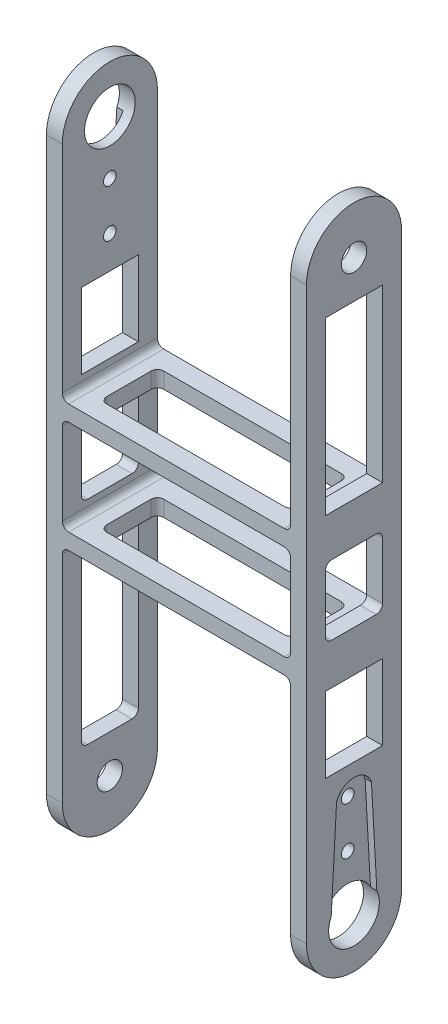
from build123d import *
from build123d.topology import SkipClean

# Parameters (mm, degrees)
EXTRUDE_1_DEPTH                 = 2.5
SKETCH_6_R                      = 2
CUT_EXTRUDE_1_DEPTH             = 3
EXTRUDE_2_DEPTH                 = 2.5
CUT_EXTRUDE_2_DEPTH             = 1
SKETCH_8_R                      = 4
SKETCH_8_R_2                    = 1
CUT_EXTRUDE_3_DEPTH             = 1.5
SKETCH_9_R                      = 2
CUT_EXTRUDE_4_DEPTH             = 2.5
CUT_EXTRUDE_5_DEPTH             = 1
SKETCH_11_R                     = 4
SKETCH_11_R_2                   = 1
CUT_EXTRUDE_6_DEPTH             = 1.5
EXTRUDE_3_REACH                 = 101.914
SKETCH_12_W                     = 36
SKETCH_12_H                     = 2.5
EXTRUDE_3_DIRECTION_2_REACH     = 101.914
CUT_EXTRUDE_7_REACH             = 108.035
SKETCH_13_W                     = 9
SKETCH_13_H                     = 27
SKETCH_13_H_2                   = 11
SKETCH_13_H_3                   = 11.890625
CUT_EXTRUDE_8_REACH             = 108.035
SKETCH_14_W                     = 9
SKETCH_14_H                     = 27
SKETCH_14_H_2                   = 11
SKETCH_14_H_3                   = 11.890625
CUT_EXTRUDE_8_DIRECTION_2_DEPTH = 107.035371457
CUT_EXTRUDE_9_DEPTH             = 57.857277459
CUT_EXTRUDE_9_DEPTH_BACK        = 57.857277459
SKETCH_15_W                     = 30
SKETCH_15_H                     = 9
FILLET_1_R                      = 1


with BuildPart() as part:
    # 草图4 → 凸台-拉伸1 (new body)
    with BuildSketch(Plane.ZY.offset(18)):
        with BuildLine():
            Line((-7.5, 90), (-7.5, 0))
            ThreePointArc((-7.5, 0), (0, -7.5), (7.5, 0))
            Line((7.5, 0), (7.5, 90))
            ThreePointArc((7.5, 90), (0, 97.5), (-7.5, 90))
        make_face()
    extrude(amount=EXTRUDE_1_DEPTH)

    # 草图6 → 切除-拉伸1 (cut)
    with BuildSketch(Plane.ZY.offset(20.5)):
        Circle(SKETCH_6_R)
    extrude(amount=-CUT_EXTRUDE_1_DEPTH, mode=Mode.SUBTRACT)

    # 草图10 → 切除-拉伸5 (cut)
    with BuildSketch(Plane.ZY.offset(20.5)):
        with BuildLine():
            Line((-2.75, 73), (-3.6, 88.256440423))
            ThreePointArc((-3.6, 88.256440423), (0, 94), (3.6, 88.256440423))
            Line((3.6, 88.256440423), (2.75, 73))
            ThreePointArc((2.75, 73), (0, 71), (-2.75, 73))
        make_face()
    extrude(amount=-CUT_EXTRUDE_5_DEPTH, mode=Mode.SUBTRACT)

    # 草图11 → 切除-拉伸6 (cut)
    with SkipClean():  # the faces are left unmerged after this step: merging them gives an invalid solid
        with BuildSketch(Plane.ZY.offset(19.5)):
            with Locations((0, 90)):
                Circle(SKETCH_11_R)
            with Locations((0, 74.05)):
                Circle(SKETCH_11_R_2)
            with Locations((0, 81.55)):
                Circle(SKETCH_11_R_2)
        extrude(amount=-CUT_EXTRUDE_6_DEPTH, mode=Mode.SUBTRACT)

    # 凸台-拉伸3: up to this face of the body (flat: up to its plane)
    extrude_3_end = Plane(part.part.faces().sort_by_distance((-19.25, 45, 7.5))[0])
    # 草图12 → 凸台-拉伸3 (add, up to the picked face)
    with BuildSketch(Plane.XY, mode=Mode.PRIVATE) as extrude_3_sk1:
        with Locations((0, 53.75)):
            Rectangle(SKETCH_12_W, SKETCH_12_H)
    extrude_3_tool1 = split(extrude(extrude_3_sk1.sketch, amount=EXTRUDE_3_REACH, mode=Mode.PRIVATE), bisect_by=extrude_3_end, keep=Keep.BOTH, mode=Mode.PRIVATE)
    # 草图12 → 凸台-拉伸3 (add, up to the picked face)
    with BuildSketch(Plane.XY, mode=Mode.PRIVATE) as extrude_3_sk2:
        with Locations((0, 36.25)):
            Rectangle(SKETCH_12_W, SKETCH_12_H)
    extrude_3_tool2 = split(extrude(extrude_3_sk2.sketch, amount=EXTRUDE_3_REACH, mode=Mode.PRIVATE), bisect_by=extrude_3_end, keep=Keep.BOTH, mode=Mode.PRIVATE)


with BuildPart() as body_2:
    # 草图5 → 凸台-拉伸2 (new body)
    with BuildSketch(Plane(origin=(18, 0, 0), x_dir=(0, 0, -1), z_dir=(1, 0, 0))):
        with BuildLine():
            Line((-7.5, 0), (-7.5, 90))
            ThreePointArc((-7.5, 90), (0, 97.5), (7.5, 90))
            Line((7.5, 90), (7.5, 0))
            ThreePointArc((7.5, 0), (0, -7.5), (-7.5, 0))
        make_face()
    extrude(amount=EXTRUDE_2_DEPTH)

    # 草图7 → 切除-拉伸2 (cut)
    with BuildSketch(Plane(origin=(20.5, 0, 0), x_dir=(0, 0, -1), z_dir=(1, 0, 0))):
        with BuildLine():
            Line((-3.6, 1.743559577), (-2.75, 17))
            ThreePointArc((-2.75, 17), (0, 19), (2.75, 17))
            Line((2.75, 17), (3.6, 1.743559577))
            ThreePointArc((3.6, 1.743559577), (0, -4), (-3.6, 1.743559577))
        make_face()
    extrude(amount=-CUT_EXTRUDE_2_DEPTH, mode=Mode.SUBTRACT)

    # 草图8 → 切除-拉伸3 (cut)
    with SkipClean():  # the faces are left unmerged after this step: merging them gives an invalid solid
        with BuildSketch(Plane(origin=(19.5, 0, 0), x_dir=(0, 0, -1), z_dir=(1, 0, 0))):
            Circle(SKETCH_8_R)
            with Locations((0, 15.95)):
                Circle(SKETCH_8_R_2)
            with Locations((0, 8.45)):
                Circle(SKETCH_8_R_2)
        extrude(amount=-CUT_EXTRUDE_3_DEPTH, mode=Mode.SUBTRACT)

    # 草图9 → 切除-拉伸4 (cut)
    with SkipClean():  # the faces are left unmerged after this step: merging them gives an invalid solid
        with BuildSketch(Plane(origin=(20.5, 0, 0), x_dir=(0, 0, -1), z_dir=(1, 0, 0))):
            with Locations((0, 90)):
                Circle(SKETCH_9_R)
        extrude(amount=-CUT_EXTRUDE_4_DEPTH, mode=Mode.SUBTRACT)


with BuildPart() as part_1:
    add(part.part)

    add(body_2.part)  # 凸台-拉伸3 merges body 2
    add(extrude_3_tool1.solids().sort_by(Axis((0, 53.75, 0), (0, 0, 1)))[0])
    add(extrude_3_tool2.solids().sort_by(Axis((0, 36.25, 0), (0, 0, 1)))[0])

    # 凸台-拉伸3 direction 2: up to this face of the body (flat: up to its plane)
    extrude_3_direction_2_end = Plane(part_1.part.faces().sort_by_distance((-19.25, 45, -7.5))[0])
    # 草图12 → 凸台-拉伸3 direction 2 (add, up to the picked face)
    with BuildSketch(Plane.XY, mode=Mode.PRIVATE) as extrude_3_direction_2_sk1:
        with Locations((0, 53.75)):
            Rectangle(SKETCH_12_W, SKETCH_12_H)
    extrude_3_direction_2_tool1 = split(extrude(extrude_3_direction_2_sk1.sketch, amount=-EXTRUDE_3_DIRECTION_2_REACH, mode=Mode.PRIVATE), bisect_by=extrude_3_direction_2_end, keep=Keep.BOTH, mode=Mode.PRIVATE)
    # 草图12 → 凸台-拉伸3 direction 2 (add, up to the picked face)
    with BuildSketch(Plane.XY, mode=Mode.PRIVATE) as extrude_3_direction_2_sk2:
        with Locations((0, 36.25)):
            Rectangle(SKETCH_12_W, SKETCH_12_H)
    extrude_3_direction_2_tool2 = split(extrude(extrude_3_direction_2_sk2.sketch, amount=-EXTRUDE_3_DIRECTION_2_REACH, mode=Mode.PRIVATE), bisect_by=extrude_3_direction_2_end, keep=Keep.BOTH, mode=Mode.PRIVATE)
    add(extrude_3_direction_2_tool1.solids().sort_by(Axis((0, 53.75, 0), (0, 0, -1)))[0])
    add(extrude_3_direction_2_tool2.solids().sort_by(Axis((0, 36.25, 0), (0, 0, -1)))[0])

    # 草图13 → 切除-拉伸7 (cut, up to next)
    with BuildSketch(Plane.ZY.offset(20.5), mode=Mode.PRIVATE) as cut_extrude_7_sk1:
        with Locations((0, 19.5)):
            Rectangle(SKETCH_13_W, SKETCH_13_H)
    cut_extrude_7_tool1 = extrude(cut_extrude_7_sk1.sketch, amount=-CUT_EXTRUDE_7_REACH, mode=Mode.PRIVATE) & part_1.part
    # 草图13 → 切除-拉伸7 (cut, up to next)
    with BuildSketch(Plane.ZY.offset(20.5), mode=Mode.PRIVATE) as cut_extrude_7_sk2:
        with Locations((0, 45)):
            Rectangle(SKETCH_13_W, SKETCH_13_H_2)
    cut_extrude_7_tool2 = extrude(cut_extrude_7_sk2.sketch, amount=-CUT_EXTRUDE_7_REACH, mode=Mode.PRIVATE) & part_1.part
    # 草图13 → 切除-拉伸7 (cut, up to next)
    with BuildSketch(Plane.ZY.offset(20.5), mode=Mode.PRIVATE) as cut_extrude_7_sk3:
        with Locations((0, 62.9453125)):
            Rectangle(SKETCH_13_W, SKETCH_13_H_3)
    cut_extrude_7_tool3 = extrude(cut_extrude_7_sk3.sketch, amount=-CUT_EXTRUDE_7_REACH, mode=Mode.PRIVATE) & part_1.part
    add(cut_extrude_7_tool1.solids().sort_by_distance((-20.5, 19.5, 0))[0], mode=Mode.SUBTRACT)
    add(cut_extrude_7_tool2.solids().sort_by_distance((-20.5, 45, 0))[0], mode=Mode.SUBTRACT)
    add(cut_extrude_7_tool3.solids().sort_by_distance((-20.5, 62.945312, 0))[0], mode=Mode.SUBTRACT)

    # 草图14 → 切除-拉伸8 (cut, up to next)
    with BuildSketch(Plane(origin=(20.5, 0, 0), x_dir=(0, 0, -1), z_dir=(1, 0, 0)), mode=Mode.PRIVATE) as cut_extrude_8_sk1:
        with Locations((0, 70.5)):
            Rectangle(SKETCH_14_W, SKETCH_14_H)
    cut_extrude_8_tool1 = extrude(cut_extrude_8_sk1.sketch, amount=-CUT_EXTRUDE_8_REACH, mode=Mode.PRIVATE) & part_1.part
    # 草图14 → 切除-拉伸8 (cut, up to next)
    with BuildSketch(Plane(origin=(20.5, 0, 0), x_dir=(0, 0, -1), z_dir=(1, 0, 0)), mode=Mode.PRIVATE) as cut_extrude_8_sk2:
        with Locations((0, 45)):
            Rectangle(SKETCH_14_W, SKETCH_14_H_2)
    cut_extrude_8_tool2 = extrude(cut_extrude_8_sk2.sketch, amount=-CUT_EXTRUDE_8_REACH, mode=Mode.PRIVATE) & part_1.part
    # 草图14 → 切除-拉伸8 (cut, up to next)
    with BuildSketch(Plane(origin=(20.5, 0, 0), x_dir=(0, 0, -1), z_dir=(1, 0, 0)), mode=Mode.PRIVATE) as cut_extrude_8_sk3:
        with Locations((0, 27.0546875)):
            Rectangle(SKETCH_14_W, SKETCH_14_H_3)
    cut_extrude_8_tool3 = extrude(cut_extrude_8_sk3.sketch, amount=-CUT_EXTRUDE_8_REACH, mode=Mode.PRIVATE) & part_1.part
    add(cut_extrude_8_tool1.solids().sort_by_distance((20.5, 70.5, 0))[0], mode=Mode.SUBTRACT)
    add(cut_extrude_8_tool2.solids().sort_by_distance((20.5, 45, 0))[0], mode=Mode.SUBTRACT)
    add(cut_extrude_8_tool3.solids().sort_by_distance((20.5, 27.054688, 0))[0], mode=Mode.SUBTRACT)

    # 草图14 → 切除-拉伸8 direction 2 (cut)
    with SkipClean():  # the faces are left unmerged after this step: merging them gives an invalid solid
        with BuildSketch(Plane(origin=(20.5, 0, 0), x_dir=(0, 0, -1), z_dir=(1, 0, 0))):
            with Locations((0, 70.5)):
                Rectangle(SKETCH_14_W, SKETCH_14_H)
            with Locations((0, 45)):
                Rectangle(SKETCH_14_W, SKETCH_14_H_2)
            with Locations((0, 27.0546875)):
                Rectangle(SKETCH_14_W, SKETCH_14_H_3)
        extrude(amount=CUT_EXTRUDE_8_DIRECTION_2_DEPTH, mode=Mode.SUBTRACT)

    # 草图15 → 切除-拉伸9 (cut, two sides: drawn at the far end of the back side and taken through both)
    with SkipClean():  # the faces are left unmerged after this step: merging them gives an invalid solid
        with BuildSketch(Plane(origin=(0, 45, 0), x_dir=(1, 0, 0), z_dir=(0, 1, 0)).offset(-CUT_EXTRUDE_9_DEPTH_BACK)):
            Rectangle(SKETCH_15_W, SKETCH_15_H)
        extrude(amount=CUT_EXTRUDE_9_DEPTH + CUT_EXTRUDE_9_DEPTH_BACK, mode=Mode.SUBTRACT)

    # 圆角1
    fillet_1_edges = [part_1.edges().sort_by_distance(p)[0] for p in [
        (-19.25, 33, -4.5),
        (-19.25, 6, -4.5),
        (-19.25, 6, 4.5),
        (-19.25, 33, 4.5),
        (-19.25, 50.5, -4.5),
        (-19.25, 39.5, -4.5),
        (-19.25, 39.5, 4.5),
        (-19.25, 50.5, 4.5),
        (19.25, 50.5, 4.5),
        (19.25, 39.5, 4.5),
        (19.25, 39.5, -4.5),
        (19.25, 50.5, -4.5),
        (-15, 53.75, 4.5),
        (-15, 36.25, 4.5),
        (-15, 53.75, -4.5),
        (-15, 36.25, -4.5),
        (15, 53.75, -4.5),
        (15, 36.25, -4.5),
        (15, 53.75, 4.5),
        (15, 36.25, 4.5),
        (-18, 52.5, -3.75),
        (-18, 55, -3.75),
        (18, 55, 3.75),
        (18, 52.5, 3.75),
        (18, 37.5, 3.75),
        (18, 35, 3.75),
        (-18, 35, -3.75),
        (-18, 37.5, -3.75),
    ]]
    fillet(fillet_1_edges, radius=FILLET_1_R)


solid = part_1.part
